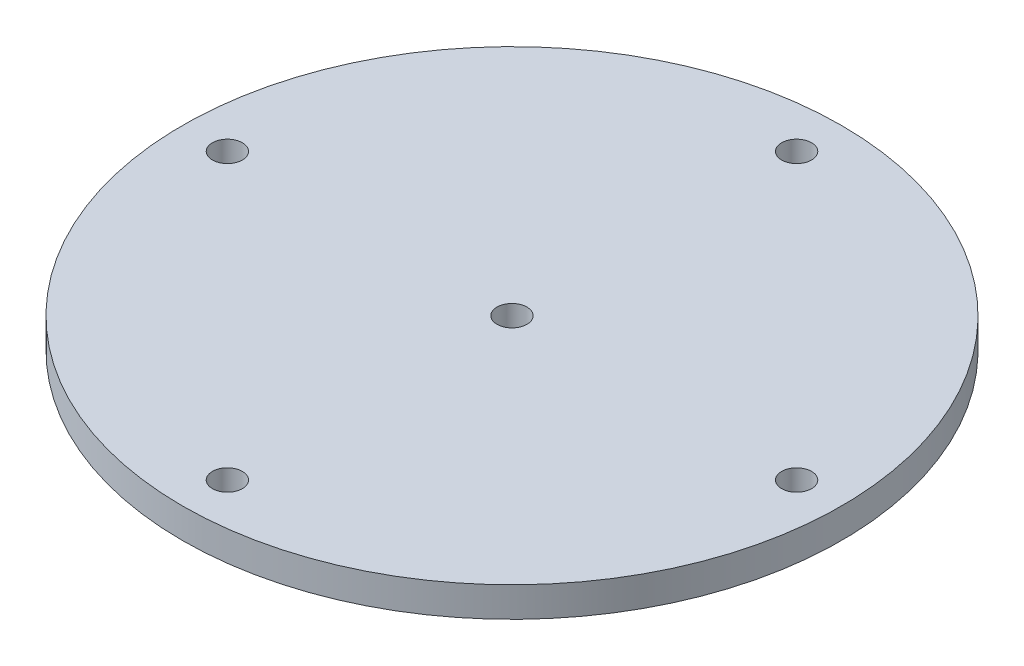
from build123d import *

# Parameters (mm, degrees)
SKETCH1_R           = 220
SKETCH1_R_2         = 10
BOSS_EXTRUDE1_DEPTH = 20


with BuildPart() as part:
    # Sketch1 → Boss-Extrude1 (new body)
    with BuildSketch(Plane(origin=(0, 0, 0), x_dir=(1, 0, 0), z_dir=(0, 1, 0))):
        Circle(SKETCH1_R)
        with Locations((0, 190)):
            Circle(SKETCH1_R_2, mode=Mode.SUBTRACT)
        with Locations((190, 0)):
            Circle(SKETCH1_R_2, mode=Mode.SUBTRACT)
        with Locations((0, -190)):
            Circle(SKETCH1_R_2, mode=Mode.SUBTRACT)
        with Locations((-190, 0)):
            Circle(SKETCH1_R_2, mode=Mode.SUBTRACT)
        Circle(SKETCH1_R_2, mode=Mode.SUBTRACT)
    extrude(amount=BOSS_EXTRUDE1_DEPTH)


with BuildPart() as body_2:
    # Sketch2 → Revolve2 (revolve)
    with BuildSketch(Plane.XY):
        Polygon((10, 0), (0, 0), (0, -10), align=None)
    revolve(axis=Axis((0, 0, 0), (0, -1, 0)))


with BuildPart() as body_3:
    # Sketch2<3> → Revolve3 (revolve)
    with BuildSketch(Plane.XY):
        Polygon((-190, -10), (-180, 0), (-190, 0), align=None)
    revolve(axis=Axis((-190, 0, 0), (0, -1, 0)))


with BuildPart() as body_4:
    # Sketch4 → Revolve4 (revolve)
    with BuildSketch(Plane(origin=(0, 0, 0), x_dir=(0, 0, -1), z_dir=(1, 0, 0))):
        Polygon((-190, -10), (-180, 0), (-190, 0), align=None)
    revolve(axis=Axis((0, -10, 190), (0, 1, 0)))


with BuildPart() as body_5:
    # Sketch2<4> → Revolve5 (revolve)
    with BuildSketch(Plane.XY):
        Polygon((190, -10), (190, 0), (180, 0), align=None)
    revolve(axis=Axis((190, 0, 0), (0, -1, 0)))


with BuildPart() as body_6:
    # Sketch4<3> → Revolve7 (revolve)
    with BuildSketch(Plane(origin=(0, 0, 0), x_dir=(0, 0, -1), z_dir=(1, 0, 0))):
        Polygon((180, 0), (190, -10), (190, 0), align=None)
    revolve(axis=Axis((0, -10, -190), (0, 1, 0)))


solid = Compound([part.part, body_2.part, body_3.part, body_4.part, body_5.part, body_6.part])
